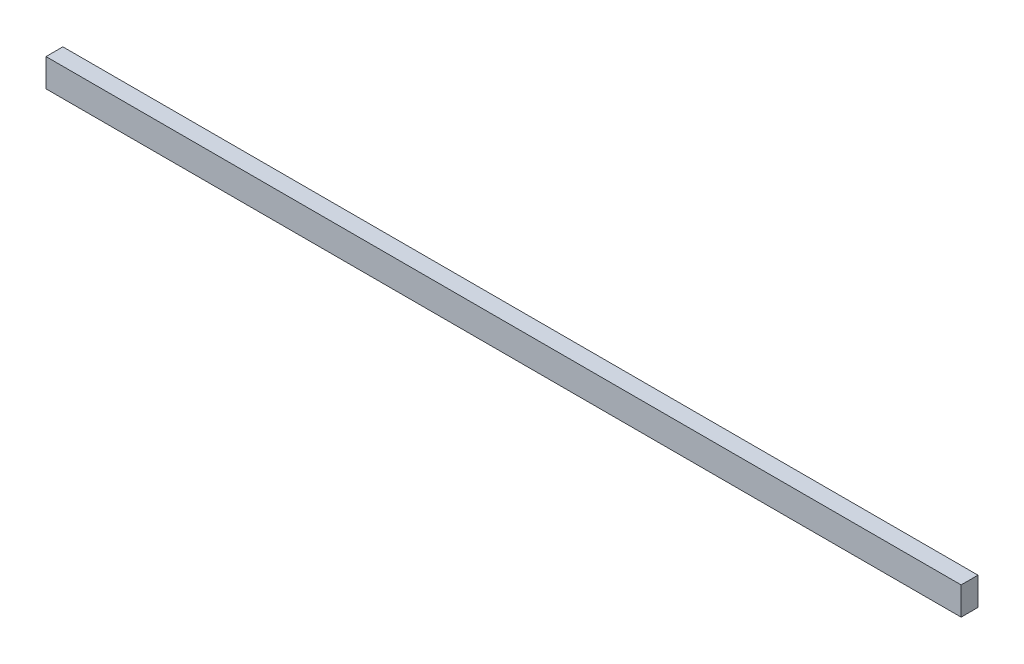
from build123d import *

# Parameters (mm, degrees)
BOSS_EXTRUDE1_DEPTH      = 8.382
BOSS_EXTRUDE1_DEPTH_BACK = 12.7
SKETCH1_W                = 1143
SKETCH1_H                = 34.933525114


with BuildPart() as part:
    # Sketch1 → Boss-Extrude1 (new, two sides: drawn at the far end of the back side and taken through both)
    with BuildSketch(Plane.XY.offset(-BOSS_EXTRUDE1_DEPTH_BACK)):
        Rectangle(SKETCH1_W, SKETCH1_H)
    extrude(amount=BOSS_EXTRUDE1_DEPTH + BOSS_EXTRUDE1_DEPTH_BACK)


solid = part.part
